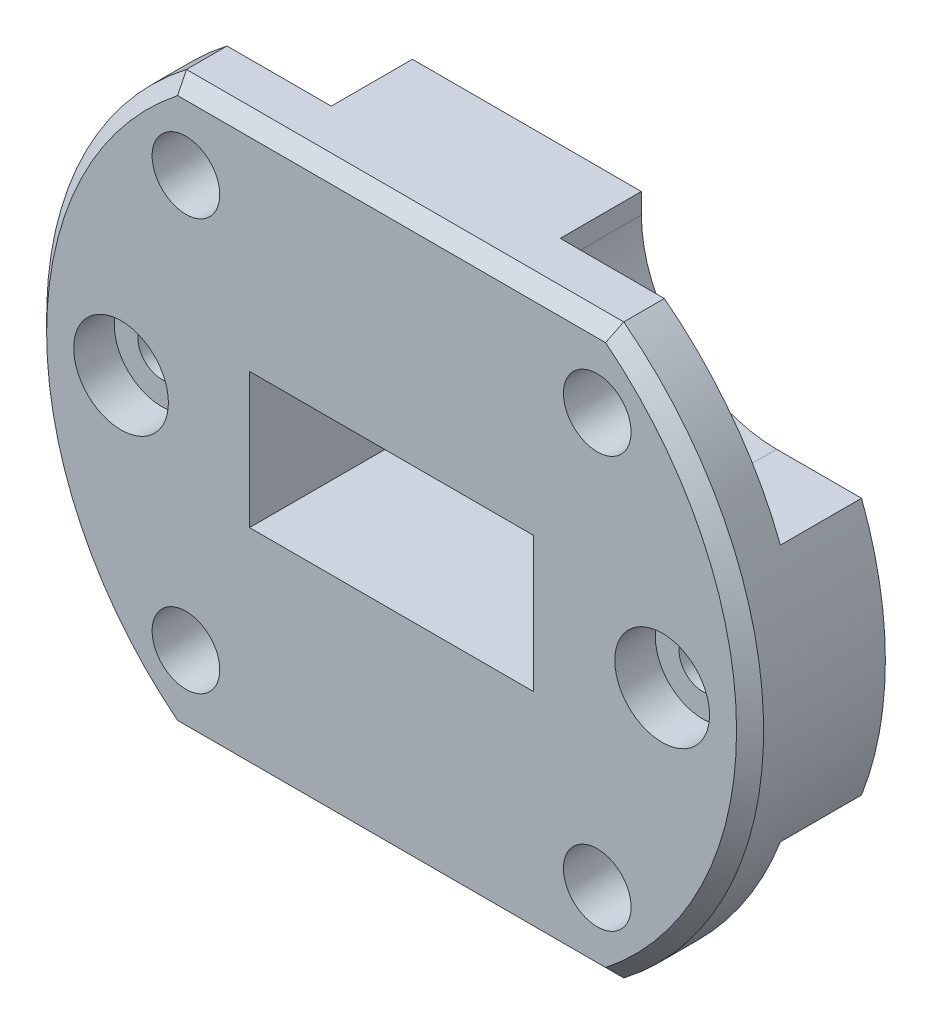
from build123d import *

# Parameters (mm, degrees)
SKETCH_1_R               = 26.5
EXTRUDE_1_DEPTH          = 10
SKETCH_5_R               = 2.5
CUT_EXTRUDE_4_DEPTH      = 39.787884706
PATTERN_CIRCULAR_1_COUNT = 4
CHAMFER_1_SIZE           = 1
SKETCH_6_W               = 30
SKETCH_6_H               = 30
SKETCH_8_W               = 21
SKETCH_8_H               = 10
CUT_EXTRUDE_5_DEPTH      = 36.259750425
SKETCH_9_R               = 2.5
CUT_EXTRUDE_7_DEPTH      = 6
MIRROR_3_COPY_1_SKETCH_R = 2.5
MIRROR_3_COPY_1_DEPTH    = 6
SKETCH_12_R              = 3.5
CUT_EXTRUDE_8_DEPTH      = 3
SKETCH_13_R              = 1.75
CUT_EXTRUDE_9_DEPTH      = 35.528973341
CHAMFER_2_SIZE           = 1


with BuildPart() as part:
    # Эскиз1 → Бобышка-Вытянуть1 (new body)
    with BuildSketch(Plane.XY):
        Circle(SKETCH_1_R)
    extrude(amount=EXTRUDE_1_DEPTH)

    # Эскиз5 → Вырез-Вытянуть4 (cut, through all)
    with BuildSketch(Plane.XY.offset(10)):
        with Locations((-15.202795796, 15.202795796)):
            Circle(SKETCH_5_R)
    cut_extrude_4 = extrude(amount=-CUT_EXTRUDE_4_DEPTH, mode=Mode.SUBTRACT)

    # Круговой массив1: Вырез-Вытянуть4 ×4 about axis
    pattern_circular_1_axis = Axis((0, 0, 0), (0, 0, 1))
    for i in range(1, PATTERN_CIRCULAR_1_COUNT):
        add(cut_extrude_4.rotate(pattern_circular_1_axis, i * 360 / PATTERN_CIRCULAR_1_COUNT), mode=Mode.SUBTRACT)

    # Фаска1
    chamfer_1_edges = [part.edges().sort_by_distance(p)[0] for p in [
        (-26.5, 0, 10),
    ]]
    chamfer(chamfer_1_edges, length=CHAMFER_1_SIZE)

    # Эскиз6 → Вырез-Повернуть1 (revolve, cut)
    with BuildSketch(Plane.XY):
        with Locations((15, 36)):
            Rectangle(SKETCH_6_W, SKETCH_6_H)
    cut_revolve_1 = revolve(axis=Axis((0, 0, 0), (0, 1, 0)), mode=Mode.SUBTRACT)

    # Зеркальное отражение1: Вырез-Повернуть1 across plane
    add(cut_revolve_1.mirror(Plane.ZX), mode=Mode.SUBTRACT)

    # Эскиз8 → Вырез-Вытянуть5 (cut, through all)
    with BuildSketch(Plane.XY.offset(10)):
        Rectangle(SKETCH_8_W, SKETCH_8_H)
    extrude(amount=-CUT_EXTRUDE_5_DEPTH, mode=Mode.SUBTRACT)

    # Эскиз9 → Вырез-Вытянуть7 (cut)
    # profile 1 of 2: a face of its own
    with BuildSketch(Plane(origin=(0, 0, 0), x_dir=(-1, 0, 0), z_dir=(0, 0, -1))):
        with BuildLine():
            Line((28.463229875, -9.5), (24.738633754, -9.5))
            ThreePointArc((24.738633754, -9.5), (21.243895878, -15.841303227), (16.163229875, -21))
            Line((16.163229875, -21), (8.463229875, -21))
            Line((8.463229875, -21), (8.463229875, -29.5))
            Line((8.463229875, -29.5), (18.463229875, -29.5))
            Line((18.463229875, -29.5), (28.463229875, -29.5))
            Line((28.463229875, -29.5), (28.463229875, -19.5))
            Line((28.463229875, -19.5), (28.463229875, -9.5))
        make_face()
    # profile 2 of 2: a face of its own
    with BuildSketch(Plane(origin=(0, 0, 0), x_dir=(-1, 0, 0), z_dir=(0, 0, -1))):
        with BuildLine():
            Line((24.738633754, -9.5), (18.463229875, -9.5))
            ThreePointArc((18.463229875, -9.5), (11.392162063, -12.428932188), (8.463229875, -19.5))
            Line((8.463229875, -19.5), (8.463229875, -21))
            Line((8.463229875, -21), (16.163229875, -21))
            ThreePointArc((16.163229875, -21), (21.243895878, -15.841303227), (24.738633754, -9.5))
        make_face()
        with Locations(Location((15.202795796, -15.202795796, 0), (0, 0, 180))):
            Circle(SKETCH_9_R, mode=Mode.SUBTRACT)
    cut_extrude_7 = extrude(amount=-CUT_EXTRUDE_7_DEPTH, mode=Mode.SUBTRACT)

    # Зеркальное отражение2: Вырез-Вытянуть7 across plane
    add(cut_extrude_7.mirror(Plane.ZX), mode=Mode.SUBTRACT)

    # Зеркальное отражение3: Вырез-Вытянуть7 across plane
    add(cut_extrude_7.mirror(Plane(origin=(0, 0, 0), x_dir=(0, 0, 1), z_dir=(1, 0, 0))), mode=Mode.SUBTRACT)

    # Зеркальное отражение3 copy 1 sketch → Зеркальное отражение3 copy 1 (cut)
    # profile 1 of 2: a face of its own
    with BuildSketch(Plane(origin=(0, 0, 0), x_dir=(1, 0, 0), z_dir=(0, 0, -1))):
        with BuildLine():
            Line((28.463229875, -9.5), (24.738633754, -9.5))
            ThreePointArc((24.738633754, -9.5), (21.243895878, -15.841303227), (16.163229875, -21))
            Line((16.163229875, -21), (8.463229875, -21))
            Line((8.463229875, -21), (8.463229875, -29.5))
            Line((8.463229875, -29.5), (18.463229875, -29.5))
            Line((18.463229875, -29.5), (28.463229875, -29.5))
            Line((28.463229875, -29.5), (28.463229875, -19.5))
            Line((28.463229875, -19.5), (28.463229875, -9.5))
        make_face()
    # profile 2 of 2: a face of its own
    with BuildSketch(Plane(origin=(0, 0, 0), x_dir=(1, 0, 0), z_dir=(0, 0, -1))):
        with BuildLine():
            Line((24.738633754, -9.5), (18.463229875, -9.5))
            ThreePointArc((18.463229875, -9.5), (11.392162063, -12.428932188), (8.463229875, -19.5))
            Line((8.463229875, -19.5), (8.463229875, -21))
            Line((8.463229875, -21), (16.163229875, -21))
            ThreePointArc((16.163229875, -21), (21.243895878, -15.841303227), (24.738633754, -9.5))
        make_face()
        with Locations(Location((15.202795796, -15.202795796, 0), (0, 0, 180))):
            Circle(MIRROR_3_COPY_1_SKETCH_R, mode=Mode.SUBTRACT)
    extrude(amount=-MIRROR_3_COPY_1_DEPTH, mode=Mode.SUBTRACT)

    # Эскиз12 → Вырез-Вытянуть8 (cut)
    with BuildSketch(Plane.XY.offset(10)):
        with Locations((-20, 0)):
            Circle(SKETCH_12_R)
    cut_extrude_8 = extrude(amount=-CUT_EXTRUDE_8_DEPTH, mode=Mode.SUBTRACT)

    # Эскиз13 → Вырез-Вытянуть9 (cut, through all)
    with BuildSketch(Plane.XY.offset(7)):
        with Locations((-20, 0)):
            Circle(SKETCH_13_R)
    cut_extrude_9 = extrude(amount=-CUT_EXTRUDE_9_DEPTH, mode=Mode.SUBTRACT)

    # Зеркальное отражение4: Вырез-Вытянуть8, Вырез-Вытянуть9 across plane
    add(cut_extrude_8.mirror(Plane(origin=(0, 0, 0), x_dir=(0, 0, 1), z_dir=(1, 0, 0))), mode=Mode.SUBTRACT)
    add(cut_extrude_9.mirror(Plane(origin=(0, 0, 0), x_dir=(0, 0, 1), z_dir=(1, 0, 0))), mode=Mode.SUBTRACT)

    # Фаска2
    chamfer_2_edges = [part.edges().sort_by_distance(p)[0] for p in [
        (0, -21, 10),
        (0, 21, 10),
    ]]
    chamfer(chamfer_2_edges, length=CHAMFER_2_SIZE)


solid = part.part
